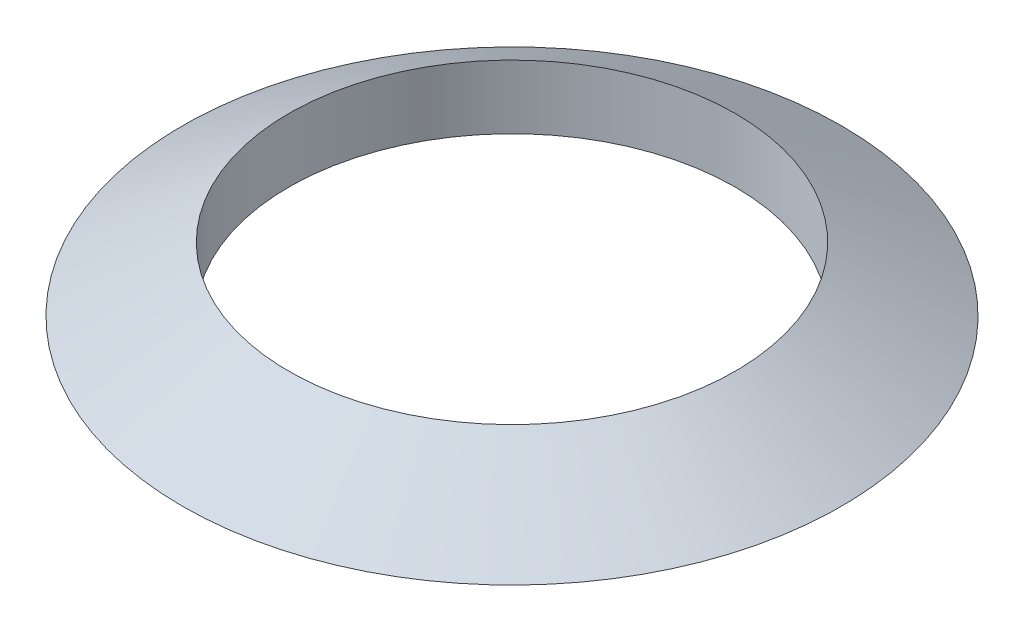
from build123d import *


with BuildPart() as part:
    # 草图2 → 旋转1 (revolve)
    with BuildSketch(Plane.XY, mode=Mode.PRIVATE) as revolve_1_sk:
        Polygon((-155, 0), (-105, 0), (-105, 30), align=None)
    revolve(revolve_1_sk.sketch.rotate(Axis((0, 0, 0), (0, 1, 0)), 270), axis=Axis((0, 0, 0), (0, 1, 0)))


solid = part.part
